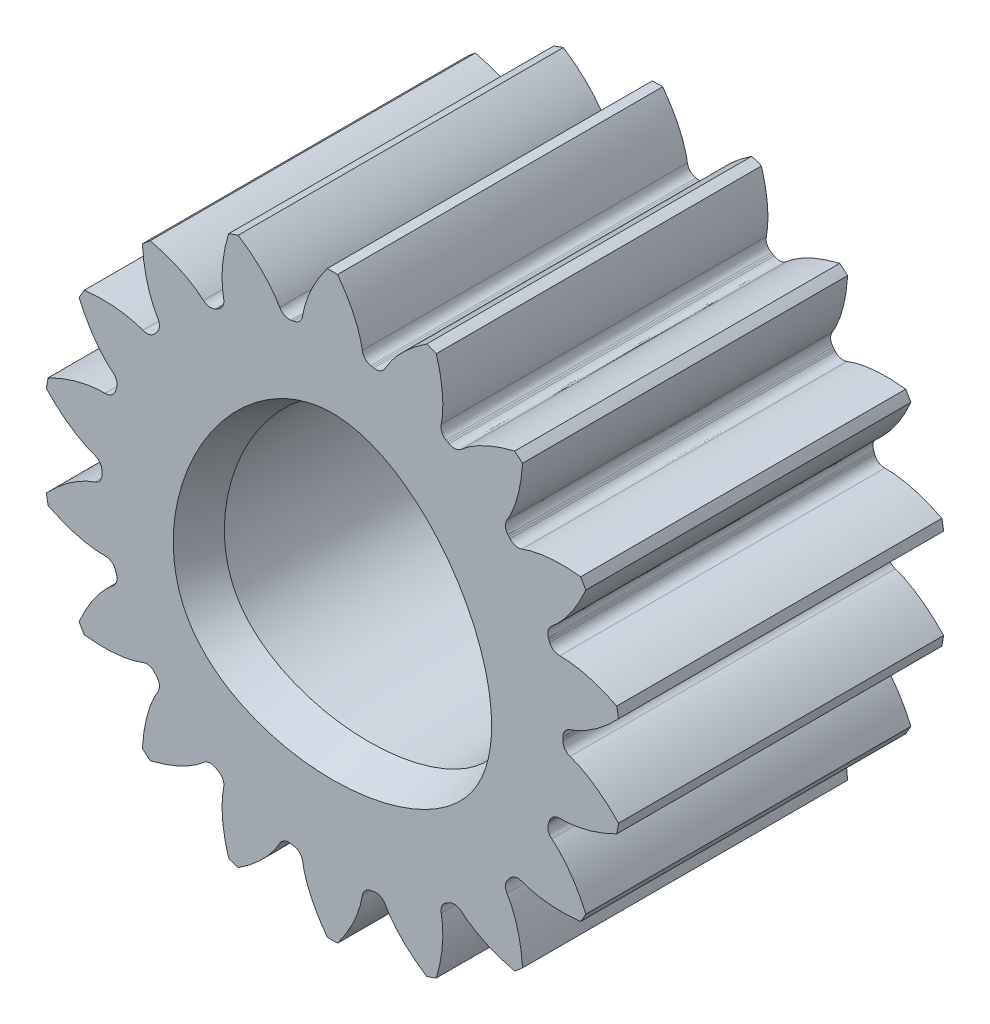
from build123d import *

# Parameters (mm, degrees)
BOSS_EXTRUDE1_DEPTH      = 9
BOSS_EXTRUDE1_DEPTH_BACK = 9
SKETCH1_R                = 16.0345
CUT_EXTRUDE1_START       = -9
CUT_EXTRUDE1_DEPTH       = 18
CIRPATTERN1_COUNT        = 18
CUT_EXTRUDE2_DEPTH       = 18
CUT_EXTRUDE2_TAPER       = 2.65
CHAMFER1_SIZE            = 2
CHAMFER1_SIZE2           = 0.741206156


with BuildPart() as part:
    # Sketch1 → Boss-Extrude1 (new, two sides: drawn at the far end of the back side and taken through both)
    with BuildSketch(Plane.XY.offset(-BOSS_EXTRUDE1_DEPTH_BACK)):
        Circle(SKETCH1_R)
    extrude(amount=BOSS_EXTRUDE1_DEPTH + BOSS_EXTRUDE1_DEPTH_BACK)

    # Sketch2 → Cut-Extrude1 (cut)
    with BuildSketch(Plane.XY.offset(CUT_EXTRUDE1_START)):
        with BuildLine():
            Line((5.214823842, 15.16280985), (5.423416795, 15.769322244))
            ThreePointArc((5.423416795, 15.769322244), (2.895736173, 16.422535912), (0.297081112, 16.673233537))
            Line((0.297081112, 16.673233537), (0.285654915, 16.031955324))
            add(Edge.make_bspline(
                [(0.285654915, 16.031955324), (0.767185844, 15.385565398), (1.123566803, 14.774160551), (1.369184958, 14.22072338), (1.523629879, 13.744240633), (1.609966452, 13.358037963), (1.652753118, 13.069342232)],
                knots=[0, 0, 0, 0, 0, 0, 0, 1, 1, 1, 1, 1, 1, 1], degree=6))
            add(Edge.make_bspline(
                [(1.652753118, 13.069342232), (1.65690486, 13.041303758), (1.668991922, 12.986299485), (1.698350668, 12.908124296), (1.737718721, 12.836284444), (1.785987822, 12.771662534), (1.84229624, 12.714839563), (1.905620083, 12.666581458), (1.974800727, 12.627632859), (2.048568857, 12.598635126), (2.099908792, 12.586265226), (2.125873398, 12.581878812)],
                knots=[0, 0, 0, 0, 0.117046642, 0.231959645, 0.343942671, 0.454480363, 0.564216465, 0.673478121, 0.782453612, 0.891264558, 1, 1, 1, 1], degree=3))
            add(Edge.make_bspline(
                [(2.125873398, 12.581878812), (2.155863162, 12.576811649), (2.185834809, 12.57163726), (2.215787573, 12.56635578)],
                knots=[0, 0, 0, 0, 1, 1, 1, 1], degree=3))
            add(Edge.make_bspline(
                [(2.215787573, 12.56635578), (2.245740337, 12.561074299), (2.275674218, 12.555685727), (2.30558845, 12.5501902)],
                knots=[0, 0, 0, 0, 1, 1, 1, 1], degree=3))
            add(Edge.make_bspline(
                [(2.30558845, 12.5501902), (2.33148744, 12.545431662), (2.383961954, 12.539496274), (2.46319913, 12.541515043), (2.541528876, 12.554453581), (2.617539067, 12.578143336), (2.689886274, 12.612280849), (2.757346386, 12.656496577), (2.818910931, 12.710539288), (2.873236618, 12.773958654), (2.90340731, 12.821511744), (2.916898394, 12.846439312)],
                knots=[0, 0, 0, 0, 0.108735442, 0.217546388, 0.326521879, 0.435783535, 0.545519637, 0.656057329, 0.768040355, 0.882953358, 1, 1, 1, 1], degree=3))
            add(Edge.make_bspline(
                [(2.916898394, 12.846439312), (3.055844464, 13.103090659), (3.269063397, 13.43647361), (3.577160847, 13.831397658), (3.997253075, 14.267452127), (4.541254406, 14.720095284), (5.214823842, 15.16280985)],
                knots=[0, 0, 0, 0, 0, 0, 0, 1, 1, 1, 1, 1, 1, 1], degree=6))
        make_face()
    cut_extrude1 = extrude(amount=CUT_EXTRUDE1_DEPTH, mode=Mode.SUBTRACT)

    # CirPattern1: Cut-Extrude1 ×18 about axis
    cirpattern1_axis = Axis((0, 0, -12.5), (0, 0, 1))
    for i in range(1, CIRPATTERN1_COUNT):
        add(cut_extrude1.rotate(cirpattern1_axis, i * 360 / CIRPATTERN1_COUNT), mode=Mode.SUBTRACT)

    # Sketch4 → Cut-Extrude2 (cut)
    with BuildSketch(Plane.XY.offset(9)):
        with BuildLine():
            add(Edge.make_bspline(
                [(0, 8.5), (-2.528794179, 8.5), (-7.586382537, 4.38), (-9.145228264, -5.28), (0, -8.76), (9.145228264, -5.28), (7.586382537, 4.38), (2.528794179, 8.5), (0, 8.5)],
                knots=[0, 0, 0, 0, 0.166666667, 0.333333333, 0.5, 0.666666667, 0.833333333, 1, 1, 1, 1], degree=3))
        make_face()
    extrude(amount=-CUT_EXTRUDE2_DEPTH, taper=CUT_EXTRUDE2_TAPER, mode=Mode.SUBTRACT)

    # Chamfer1
    chamfer1_edges = [part.edges().sort_by_distance(p)[0] for p in [
        (-3.715981857, 7.103859056, 9),
    ]]
    chamfer1_side = [part.faces().sort_by_distance(p)[0] for p in [
        (-3.292200354, 6.898017751, 0),
    ]]
    chamfer(chamfer1_edges, length=CHAMFER1_SIZE, length2=CHAMFER1_SIZE2, reference=chamfer1_side[0])


solid = part.part
